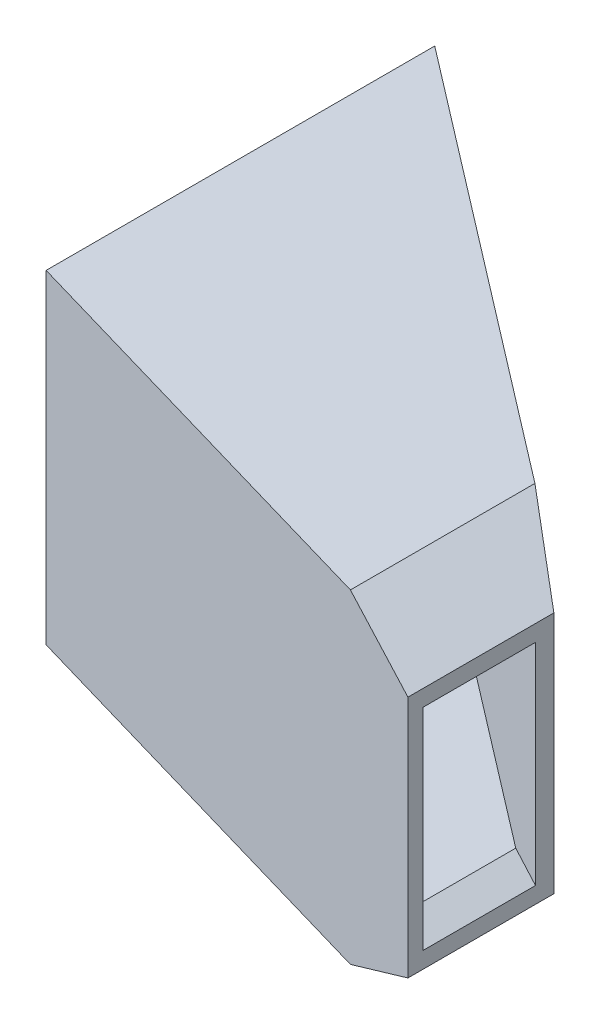
from build123d import *

# Parameters (mm, degrees)
BOSS_EXTRUDE1_DEPTH = 40
CHAMFER1_SIZE       = 5
CHAMFER1_SIZE2      = 10
CHAMFER2_SIZE       = 10
CHAMFER2_SIZE2      = 5
SHELL1_T            = -1.8


with BuildPart() as part:
    # Sketch2 → Boss-Extrude1 (new body)
    with BuildSketch(Plane(origin=(0, 0, 0), x_dir=(1, 0, 0), z_dir=(0, 1, 0))):
        Polygon((13.428152071, -6.099992503), (13.428152071, 41.830007497), (76.327388482, -6.373909949), (76.327388482, -24.373909949), align=None)
    extrude(amount=BOSS_EXTRUDE1_DEPTH)

    # Chamfer1
    chamfer1_edges = [part.edges().sort_by_distance(p)[0] for p in [
        (76.327388482, 40, 15.373909949),
    ]]
    chamfer1_side = [part.faces().sort_by_distance(p)[0] for p in [
        (76.327388482, 20, 15.373909949),
    ]]
    chamfer(chamfer1_edges, length=CHAMFER1_SIZE, length2=CHAMFER1_SIZE2, reference=chamfer1_side[0])

    # Chamfer2
    chamfer2_edges = [part.edges().sort_by_distance(p)[0] for p in [
        (76.327388482, 0, 15.373909949),
    ]]
    chamfer2_side = [part.faces().sort_by_distance(p)[0] for p in [
        (40.118747713, 0, -3.760440323),
    ]]
    chamfer(chamfer2_edges, length=CHAMFER2_SIZE, length2=CHAMFER2_SIZE2, reference=chamfer2_side[0])

    # Shell1
    shell1_openings = [part.faces().sort_by_distance(p)[0] for p in [
        (13.428152071, 20, -17.865007497),
        (76.327388482, 20, 15.373909949),
    ]]
    offset(amount=SHELL1_T, openings=shell1_openings, kind=Kind.INTERSECTION)


solid = part.part
